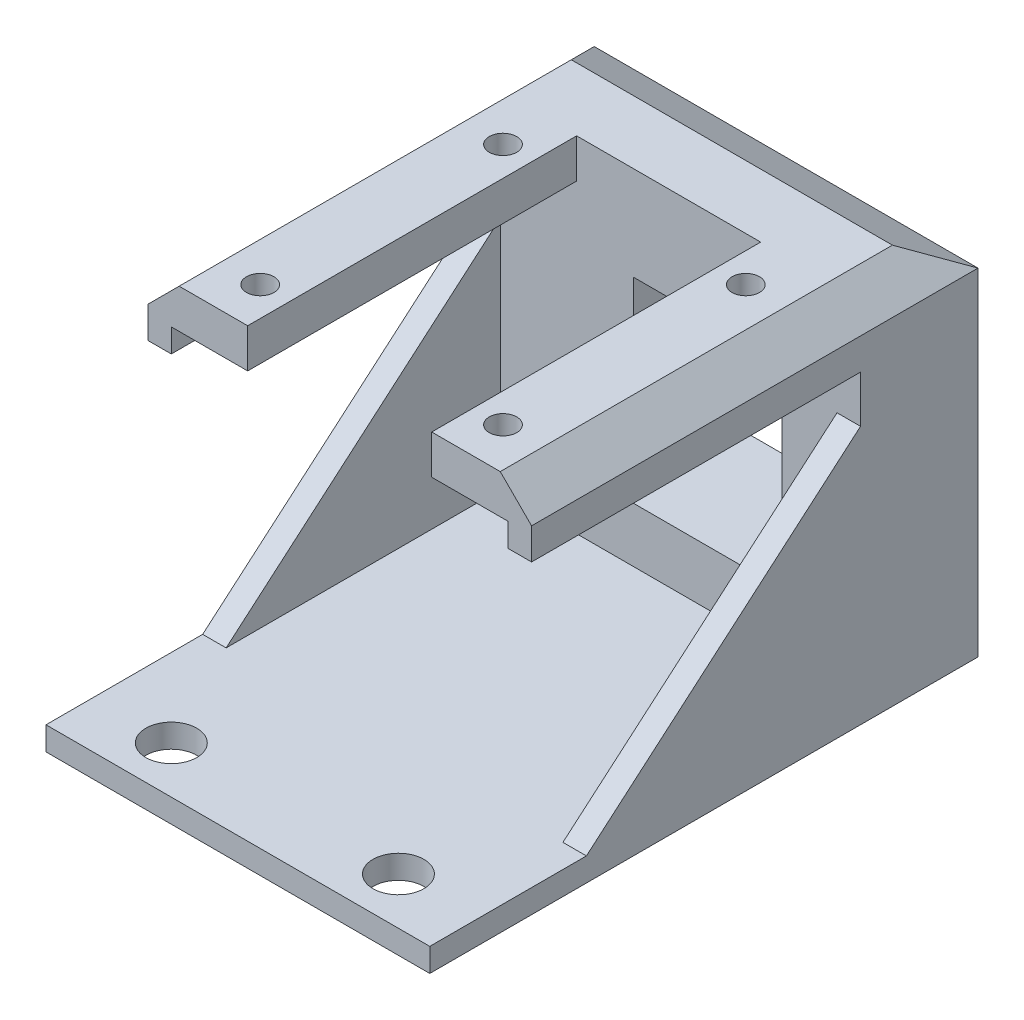
from build123d import *

# Parameters (mm, degrees)
SKETCH1_W           = 49
SKETCH1_H           = 47
BOSS_EXTRUDE1_DEPTH = 15
SKETCH2_W           = 49
SKETCH2_H           = 3
BOSS_EXTRUDE2_DEPTH = 55
BOSS_EXTRUDE3_DEPTH = 3
BOSS_EXTRUDE4_DEPTH = 3
SKETCH7_R           = 4.2
CUT_EXTRUDE1_DEPTH  = 9
BOSS_EXTRUDE5_DEPTH = 42
SKETCH9_R           = 1.75
CUT_EXTRUDE2_DEPTH  = 5
CHAMFER1_SIZE       = 4
CHAMFER2_SIZE       = 4
CHAMFER2_SIZE2      = 6.92820323
CUT_EXTRUDE3_DEPTH  = 15
SKETCH11_R          = 3.25
CUT_EXTRUDE4_DEPTH  = 3


with BuildPart() as part:
    # Sketch1 → Boss-Extrude1 (new body)
    with BuildSketch(Plane.XY):
        with Locations((-2.402173913, -0.633152174)):
            Rectangle(SKETCH1_W, SKETCH1_H)
    extrude(amount=BOSS_EXTRUDE1_DEPTH)

    # Sketch2 → Boss-Extrude2 (add)
    with BuildSketch(Plane.XY.offset(15)):
        with Locations((-2.402173913, -22.633152174)):
            Rectangle(SKETCH2_W, SKETCH2_H)
    extrude(amount=BOSS_EXTRUDE2_DEPTH)

    # Sketch4 → Boss-Extrude3 (add)
    with BuildSketch(Plane.ZY.offset(26.902173913)):
        Polygon((15, -21.133152174), (15, 8.866847826), (50, -21.133152174), align=None)
    extrude(amount=-BOSS_EXTRUDE3_DEPTH)

    # Sketch5 → Boss-Extrude4 (add)
    with BuildSketch(Plane(origin=(22.097826087, 0, 0), x_dir=(0, 0, -1), z_dir=(1, 0, 0))):
        Polygon((-15, -21.133152174), (-15, 8.866847826), (-50, -21.133152174), align=None)
    extrude(amount=-BOSS_EXTRUDE4_DEPTH)

    # Sketch7 → Cut-Extrude1 (cut)
    with BuildSketch(Plane(origin=(0, 0, 0), x_dir=(-1, 0, 0), z_dir=(0, 0, -1))):
        with Locations((16.902173913, 5.866847826)):
            Circle(SKETCH7_R)
    extrude(amount=-CUT_EXTRUDE1_DEPTH, mode=Mode.SUBTRACT)

    # Sketch8 → Boss-Extrude5 (add)
    with BuildSketch(Plane.XY.offset(15)):
        Polygon((22.097826087, 22.866847826), (9.347826087, 22.866847826), (9.347826087, 17.866847826), (19.097826087, 17.866847826), (19.097826087, 14.866847826), (22.097826087, 14.866847826), (22.097826087, 18.784653464), align=None)
        Polygon((-26.902173913, 14.866847826), (-26.902173913, 18.784653464), (-26.902173913, 22.866847826), (-14.152173913, 22.866847826), (-14.152173913, 17.866847826), (-23.902173913, 17.866847826), (-23.902173913, 14.866847826), align=None)
    extrude(amount=BOSS_EXTRUDE5_DEPTH)

    # Sketch9 → Cut-Extrude2 (cut)
    with BuildSketch(Plane(origin=(0, 22.866847826, 0), x_dir=(1, 0, 0), z_dir=(0, 1, 0))):
        with Locations(Location((13.097826087, -51.65, 0), (0, 0, 270))):
            Circle(SKETCH9_R)
        with Locations(Location((13.097826087, -20.65, 0), (0, 0, 270))):
            Circle(SKETCH9_R)
        with Locations(Location((-17.902173913, -20.65, 0), (0, 0, 270))):
            Circle(SKETCH9_R)
        with Locations(Location((-17.902173913, -51.65, 0), (0, 0, 270))):
            Circle(SKETCH9_R)
    extrude(amount=-CUT_EXTRUDE2_DEPTH, mode=Mode.SUBTRACT)

    # Chamfer1
    chamfer1_edges = [part.edges().sort_by_distance(p)[0] for p in [
        (-26.902173913, 22.866847826, 28.5),
        (22.097826087, 22.866847826, 28.5),
    ]]
    chamfer(chamfer1_edges, length=CHAMFER1_SIZE)

    # Chamfer2
    chamfer2_edges = [part.edges().sort_by_distance(p)[0] for p in [
        (-2.402173913, 22.866847826, 0),
    ]]
    chamfer2_side = [part.faces().sort_by_distance(p)[0] for p in [
        (-2.042090143, -0.953499615, 0),
    ]]
    chamfer(chamfer2_edges, length=CHAMFER2_SIZE, length2=CHAMFER2_SIZE2, reference=chamfer2_side[0])

    # Sketch10 → Cut-Extrude3 (cut)
    with BuildSketch(Plane(origin=(0, 0, 0), x_dir=(-1, 0, 0), z_dir=(0, 0, -1))):
        Polygon((-12.097826087, 10.866847826), (6.902173913, 10.866847826), (6.902173913, -4.133152174), (16.902173913, -4.133152174), (16.902173913, -14.133152174), (6.902173913, -14.133152174), (-12.097826087, -14.133152174), align=None)
    extrude(amount=-CUT_EXTRUDE3_DEPTH, mode=Mode.SUBTRACT)

    # Sketch11 → Cut-Extrude4 (cut)
    with BuildSketch(Plane(origin=(0, -21.133152174, 0), x_dir=(1, 0, 0), z_dir=(0, 1, 0))):
        with Locations(Location((12.097826087, -64, 0), (0, 0, 270))):
            Circle(SKETCH11_R)
        with Locations(Location((-16.902173913, -64, 0), (0, 0, 270))):
            Circle(SKETCH11_R)
    extrude(amount=-CUT_EXTRUDE4_DEPTH, mode=Mode.SUBTRACT)


solid = part.part
